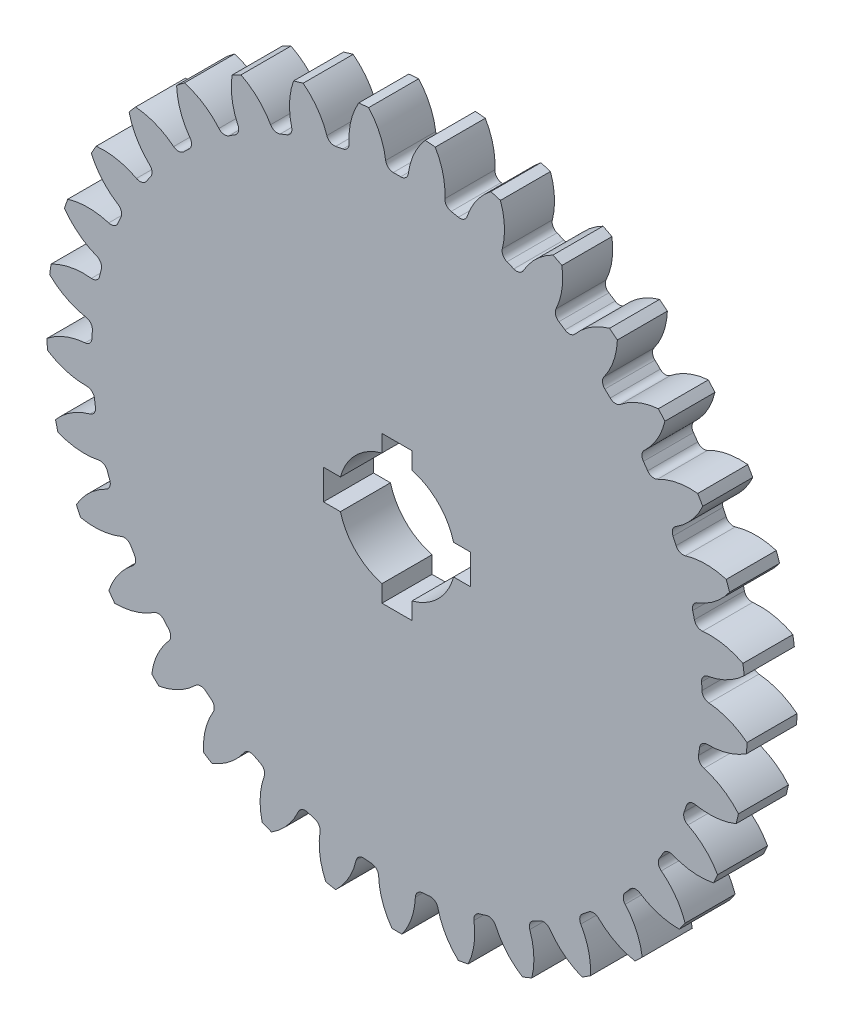
from build123d import *

# Parameters (mm, degrees)
SKETCH1_R                = 35
BOSS_EXTRUDE1_DEPTH      = 5
CUT_EXTRUDE1_DEPTH       = 10
FILLET2_R                = 0.76
CIRPATTERN2_COUNT        = 33
FILLET2_OF_CIRPATTERN2_R = 0.76
CUT_EXTRUDE2_DEPTH       = 5


with BuildPart() as part:
    # Sketch1 → Boss-Extrude1 (new body)
    with BuildSketch(Plane.XY):
        Circle(SKETCH1_R)
    extrude(amount=-BOSS_EXTRUDE1_DEPTH)

    # Sketch1<4> → Cut-Extrude1 (cut)
    with BuildSketch(Plane.XY):
        with BuildLine():
            ThreePointArc((-1.07504485, 30.481047859), (0, 30.5), (1.07504485, 30.481047859))
            ThreePointArc((1.07504485, 30.481047859), (1.569750034, 32.83546954), (2.828898766, 34.885488842))
            ThreePointArc((2.828898766, 34.885488842), (0, 35), (-2.828898766, 34.885488842))
            ThreePointArc((-2.828898766, 34.885488842), (-1.569750034, 32.83546954), (-1.07504485, 30.481047859))
        make_face()
    cut_extrude1 = extrude(amount=-CUT_EXTRUDE1_DEPTH, mode=Mode.SUBTRACT)

    # Fillet2
    fillet2_edges = [part.edges().sort_by_distance(p)[0] for p in [
        (1.07504485, 30.481047859, -2.5),
        (-1.07504485, 30.481047859, -2.5),
    ]]
    fillet(fillet2_edges, radius=FILLET2_R)

    # CirPattern2: Cut-Extrude1 ×33 about axis
    cirpattern2_axis = Axis((0, 0, 0), (0, 0, 1))
    for i in range(1, CIRPATTERN2_COUNT):
        add(cut_extrude1.rotate(cirpattern2_axis, i * 360 / CIRPATTERN2_COUNT), mode=Mode.SUBTRACT)

    # Fillet2 of CirPattern2
    fillet2_of_cirpattern2_edges = [part.edges().sort_by_distance(p)[0] for p in [
        (-4.712958847, 30.133669191, -2.5),
        (-6.824193626, 29.72676204, -2.5),
        (-10.330623933, 28.697181206, -2.5),
        (-12.326698264, 27.898073588, -2.5),
        (-15.574913353, 26.223502322, -2.5),
        (-17.38368391, 25.061076069, -2.5),
        (-20.256284825, 22.80203774, -2.5),
        (-21.812377926, 21.318305965, -2.5),
        (-24.205541386, 18.556448104, -2.5),
        (-25.452715773, 16.805036739, -2.5),
        (-27.279946614, 13.640180085, -2.5),
        (-28.173126155, 11.6843897, -2.5),
        (-29.368383494, 8.230920418, -2.5),
        (-29.875286353, 6.141438374, -2.5),
        (-30.395370477, 2.524173843, -2.5),
        (-30.497675864, 0.376519464, -2.5),
        (-30.323789576, -3.273802953, -2.5),
        (-30.017799908, -5.40200784, -2.5),
        (-29.156227911, -8.953455979, -2.5),
        (-28.453002452, -10.985292507, -2.5),
        (-26.934884205, -14.309507779, -2.5),
        (-25.859839355, -16.17154008, -2.5),
        (-23.740043605, -19.148376684, -2.5),
        (-22.332034285, -20.77330606, -2.5),
        (-19.687175975, -23.295173366, -2.5),
        (-17.997091312, -24.624270635, -2.5),
        (-14.922762511, -26.600021787, -2.5),
        (-13.011686567, -27.585249911, -2.5),
        (-9.619001529, -28.943476115, -2.5),
        (-7.556005568, -29.549226383, -2.5),
        (-3.967584769, -30.240837804, -2.5),
        (-1.827230841, -30.445216824, -2.5),
        (1.827230841, -30.445216824, -2.5),
        (3.967584769, -30.240837804, -2.5),
        (7.556005568, -29.549226383, -2.5),
        (9.619001529, -28.943476115, -2.5),
        (13.011686567, -27.585249911, -2.5),
        (14.922762511, -26.600021787, -2.5),
        (17.997091312, -24.624270635, -2.5),
        (19.687175975, -23.295173366, -2.5),
        (22.332034285, -20.77330606, -2.5),
        (23.740043605, -19.148376684, -2.5),
        (25.859839355, -16.17154008, -2.5),
        (26.934884205, -14.309507779, -2.5),
        (28.453002452, -10.985292507, -2.5),
        (29.156227911, -8.953455979, -2.5),
        (30.017799908, -5.40200784, -2.5),
        (30.323789576, -3.273802953, -2.5),
        (30.497675864, 0.376519464, -2.5),
        (30.395370477, 2.524173843, -2.5),
        (29.875286353, 6.141438374, -2.5),
        (29.368383494, 8.230920418, -2.5),
        (28.173126155, 11.6843897, -2.5),
        (27.279946614, 13.640180085, -2.5),
        (25.452715773, 16.805036739, -2.5),
        (24.205541386, 18.556448104, -2.5),
        (21.812377926, 21.318305965, -2.5),
        (20.256284825, 22.80203774, -2.5),
        (17.38368391, 25.061076069, -2.5),
        (15.574913353, 26.223502322, -2.5),
        (12.326698264, 27.898073588, -2.5),
        (10.330623933, 28.697181206, -2.5),
        (6.824193626, 29.72676204, -2.5),
        (4.712958847, 30.133669191, -2.5),
    ]]
    fillet(fillet2_of_cirpattern2_edges, radius=FILLET2_OF_CIRPATTERN2_R)

    # Sketch2 → Cut-Extrude2 (cut)
    with BuildSketch(Plane.XY):
        with BuildLine():
            Line((-1.5, 5.652839314), (-1.5, 7.348469228))
            Line((-1.5, 7.348469228), (1.5, 7.348469228))
            Line((1.5, 7.348469228), (1.5, 5.652839314))
            ThreePointArc((1.5, 5.652839314), (4.135492251, 4.135492251), (5.652839314, 1.5))
            Line((5.652839314, 1.5), (7.348469228, 1.5))
            Line((7.348469228, 1.5), (7.348469228, -1.5))
            Line((7.348469228, -1.5), (5.652839314, -1.5))
            ThreePointArc((5.652839314, -1.5), (4.135492251, -4.135492251), (1.5, -5.652839314))
            Line((1.5, -5.652839314), (1.5, -7.348469228))
            Line((1.5, -7.348469228), (-1.5, -7.348469228))
            Line((-1.5, -7.348469228), (-1.5, -5.652839314))
            ThreePointArc((-1.5, -5.652839314), (-4.135492251, -4.135492251), (-5.652839314, -1.5))
            Line((-5.652839314, -1.5), (-7.348469228, -1.5))
            Line((-7.348469228, -1.5), (-7.348469228, 1.5))
            Line((-7.348469228, 1.5), (-5.652839314, 1.5))
            ThreePointArc((-5.652839314, 1.5), (-4.135492251, 4.135492251), (-1.5, 5.652839314))
        make_face()
    extrude(amount=-CUT_EXTRUDE2_DEPTH, mode=Mode.SUBTRACT)


solid = part.part
